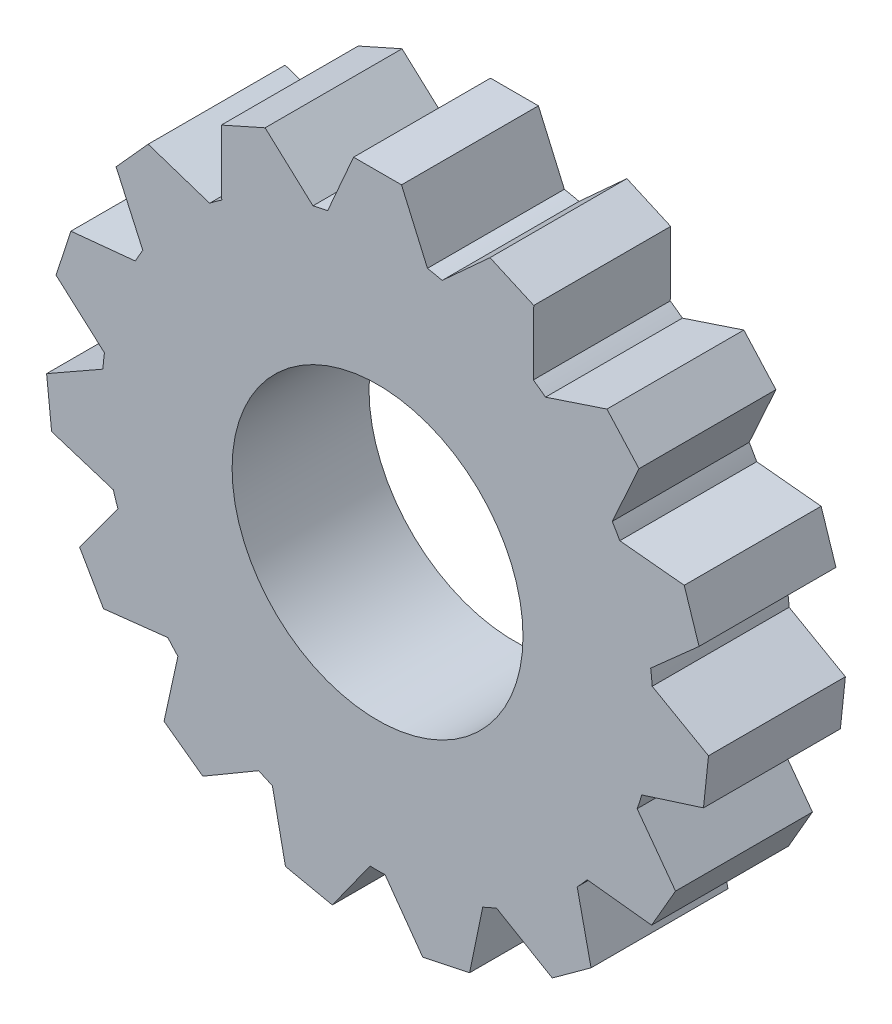
from build123d import *

# Parameters (mm, degrees)
SKETCH1_R           = 42.5
BOSS_EXTRUDE3_DEPTH = 40


with BuildPart() as part:
    # Sketch1 → Boss-Extrude3 (new body)
    with BuildSketch(Plane.XY):
        with BuildLine():
            Line((14.58274905, 79.160170984), (7, 96.492168812))
            Line((7, 96.492168812), (-7, 96.492168812))
            Line((-7, 96.492168812), (-14.58274905, 79.160170984))
            ThreePointArc((-14.58274905, 79.160170984), (-16.735262915, 78.733221802), (-18.875338057, 78.247753024))
            Line((-18.875338057, 78.247753024), (-32.852082622, 90.997139018))
            Line((-32.852082622, 90.997139018), (-45.641719029, 85.302826015))
            Line((-45.641719029, 85.302826015), (-45.519346366, 66.385076234))
            ThreePointArc((-45.519346366, 66.385076234), (-47.312109753, 65.119532483), (-49.069707737, 63.805587708))
            Line((-49.069707737, 63.805587708), (-67.023741707, 69.767877205))
            Line((-67.023741707, 69.767877205), (-76.391570197, 59.363849648))
            Line((-76.391570197, 59.363849648), (-68.585235165, 42.131398713))
            ThreePointArc((-68.585235165, 42.131398713), (-69.708262997, 40.246084406), (-70.779479165, 38.330856621))
            Line((-70.779479165, 38.330856621), (-89.60638696, 36.475115601))
            Line((-89.60638696, 36.475115601), (-93.932624881, 23.160324373))
            Line((-93.932624881, 23.160324373), (-79.792113727, 10.592819603))
            ThreePointArc((-79.792113727, 10.592819603), (-80.05122429, 8.413722711), (-80.250835633, 6.2283722))
            Line((-80.250835633, 6.2283722), (-96.695273858, -3.124524856))
            Line((-96.695273858, -3.124524856), (-95.231875373, -17.047831391))
            Line((-95.231875373, -17.047831391), (-77.202210937, -22.77735425))
            ThreePointArc((-77.202210937, -22.77735425), (-76.55260166, -24.873448077), (-75.846093565, -26.951054358))
            Line((-75.846093565, -26.951054358), (-87.064669458, -42.18390658))
            Line((-87.064669458, -42.18390658), (-80.064669458, -54.308262233))
            Line((-80.064669458, -54.308262233), (-61.263344515, -52.209116626))
            ThreePointArc((-61.263344515, -52.209116626), (-59.817338744, -53.859773725), (-58.32687288, -55.470398775))
            Line((-58.32687288, -55.470398775), (-62.37979275, -73.949307627))
            Line((-62.37979275, -73.949307627), (-51.053554829, -82.178301159))
            Line((-51.053554829, -82.178301159), (-34.731489268, -72.613448433))
            ThreePointArc((-34.731489268, -72.613448433), (-32.739114537, -73.533255194), (-30.72240599, -74.39840731))
            Line((-30.72240599, -74.39840731), (-26.908883174, -92.928201578))
            Line((-26.908883174, -92.928201578), (-13.214816763, -95.838965249))
            Line((-13.214816763, -95.838965249), (-2.194244, -80.462255334))
            ThreePointArc((-2.194244, -80.462255334), (0, -80.492168812), (2.194244, -80.462255334))
            Line((2.194244, -80.462255334), (13.214816763, -95.838965249))
            Line((13.214816763, -95.838965249), (26.908883174, -92.928201578))
            Line((26.908883174, -92.928201578), (30.72240599, -74.39840731))
            ThreePointArc((30.72240599, -74.39840731), (32.739114537, -73.533255194), (34.731489268, -72.613448433))
            Line((34.731489268, -72.613448433), (51.053554829, -82.178301159))
            Line((51.053554829, -82.178301159), (62.37979275, -73.949307627))
            Line((62.37979275, -73.949307627), (58.32687288, -55.470398775))
            ThreePointArc((58.32687288, -55.470398775), (59.817338744, -53.859773725), (61.263344515, -52.209116626))
            Line((61.263344515, -52.209116626), (80.064669458, -54.308262233))
            Line((80.064669458, -54.308262233), (87.064669458, -42.18390658))
            Line((87.064669458, -42.18390658), (75.846093565, -26.951054358))
            ThreePointArc((75.846093565, -26.951054358), (76.55260166, -24.873448077), (77.202210937, -22.77735425))
            Line((77.202210937, -22.77735425), (95.231875373, -17.047831391))
            Line((95.231875373, -17.047831391), (96.695273858, -3.124524856))
            Line((96.695273858, -3.124524856), (80.250835633, 6.2283722))
            ThreePointArc((80.250835633, 6.2283722), (80.05122429, 8.413722711), (79.792113727, 10.592819603))
            Line((79.792113727, 10.592819603), (93.932624881, 23.160324373))
            Line((93.932624881, 23.160324373), (89.60638696, 36.475115601))
            Line((89.60638696, 36.475115601), (70.779479165, 38.330856621))
            ThreePointArc((70.779479165, 38.330856621), (69.708262997, 40.246084406), (68.585235165, 42.131398713))
            Line((68.585235165, 42.131398713), (76.391570197, 59.363849648))
            Line((76.391570197, 59.363849648), (67.023741707, 69.767877205))
            Line((67.023741707, 69.767877205), (49.069707737, 63.805587708))
            ThreePointArc((49.069707737, 63.805587708), (47.312109753, 65.119532483), (45.519346366, 66.385076234))
            Line((45.519346366, 66.385076234), (45.641719029, 85.302826015))
            Line((45.641719029, 85.302826015), (32.852082622, 90.997139018))
            Line((32.852082622, 90.997139018), (18.875338057, 78.247753024))
            ThreePointArc((18.875338057, 78.247753024), (16.735262915, 78.733221802), (14.58274905, 79.160170984))
        make_face()
        Circle(SKETCH1_R, mode=Mode.SUBTRACT)
    extrude(amount=BOSS_EXTRUDE3_DEPTH)


solid = part.part
